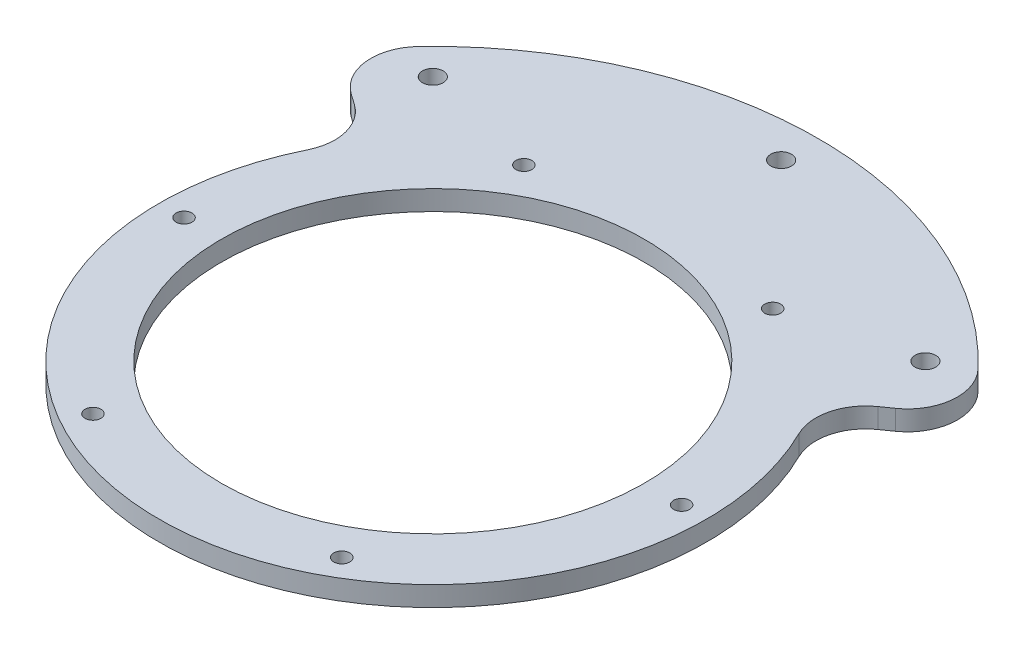
from build123d import *

# Parameters (mm, degrees)
SKETCH_1_R      = 2.075
SKETCH_1_R_2    = 1.6
EXTRUDE_1_DEPTH = 4
FILLET_1_R      = 10


with BuildPart() as part:
    # 草图1 → 凸台-拉伸1 (new body)
    # profile 1 of 3: a face of its own
    with BuildSketch(Plane(origin=(0, 0, 0), x_dir=(1, 0, 0), z_dir=(0, 1, 0))):
        with BuildLine():
            Line((-63.484283432, 44.452173817), (-45.053362436, 31.546703999))
            ThreePointArc((-45.053362436, 31.546703999), (0, 55), (45.053362436, 31.546703999))
            Line((45.053362436, 31.546703999), (63.484283432, 44.452173817))
            ThreePointArc((63.484283432, 44.452173817), (0, 77.5), (-63.484283432, 44.452173817))
        make_face()
        with Locations(Location((-49.497474683, 49.497474683, 0), (0, 0, 270))):
            Circle(SKETCH_1_R, mode=Mode.SUBTRACT)
        with Locations(Location((0, 70, 0), (0, 0, 270))):
            Circle(SKETCH_1_R, mode=Mode.SUBTRACT)
        with Locations(Location((49.497474683, 49.497474683, 0), (0, 0, 270))):
            Circle(SKETCH_1_R, mode=Mode.SUBTRACT)
    # profile 2 of 3: a face of its own
    with BuildSketch(Plane(origin=(0, 0, 0), x_dir=(1, 0, 0), z_dir=(0, 1, 0))):
        with BuildLine():
            Line((-45.053362436, 31.546703999), (-34.813961882, 24.376998545))
            ThreePointArc((-34.813961882, 24.376998545), (0, 42.5), (34.813961882, 24.376998545))
            Line((34.813961882, 24.376998545), (45.053362436, 31.546703999))
            ThreePointArc((45.053362436, 31.546703999), (0, 55), (-45.053362436, 31.546703999))
        make_face()
        with Locations(Location((-25, 43.301270189, 0), (0, 0, 270))):
            Circle(SKETCH_1_R_2, mode=Mode.SUBTRACT)
        with Locations(Location((25, 43.301270189, 0), (0, 0, 270))):
            Circle(SKETCH_1_R_2, mode=Mode.SUBTRACT)
    # profile 3 of 3: a face of its own
    with BuildSketch(Plane(origin=(0, 0, 0), x_dir=(1, 0, 0), z_dir=(0, 1, 0))):
        with BuildLine():
            ThreePointArc((42.5, 0), (-12.779996479, -40.532970407), (-34.813961882, 24.376998545))
            Line((-34.813961882, 24.376998545), (-45.053362436, 31.546703999))
            ThreePointArc((-45.053362436, 31.546703999), (-16.538818973, -52.454432291), (55, 0))
            ThreePointArc((55, 0), (52.454432291, 16.538818973), (45.053362436, 31.546703999))
            Line((45.053362436, 31.546703999), (34.813961882, 24.376998545))
            ThreePointArc((34.813961882, 24.376998545), (40.532970407, 12.779996479), (42.5, 0))
        make_face()
        with Locations(Location((-25, -43.301270189, 0), (0, 0, 270))):
            Circle(SKETCH_1_R_2, mode=Mode.SUBTRACT)
        with Locations(Location((-50, 0, 0), (0, 0, 270))):
            Circle(SKETCH_1_R_2, mode=Mode.SUBTRACT)
        with Locations(Location((25, -43.301270189, 0), (0, 0, 270))):
            Circle(SKETCH_1_R_2, mode=Mode.SUBTRACT)
        with Locations(Location((50, 0, 0), (0, 0, 270))):
            Circle(SKETCH_1_R_2, mode=Mode.SUBTRACT)
    extrude(amount=EXTRUDE_1_DEPTH)

    # 圆角1
    fillet_1_edges = [part.edges().sort_by_distance(p)[0] for p in [
        (-45.053362436, 2, -31.546703999),
        (-63.484283432, 2, -44.452173817),
        (63.484283432, 2, -44.452173817),
        (45.053362436, 2, -31.546703999),
    ]]
    fillet(fillet_1_edges, radius=FILLET_1_R)


solid = part.part
